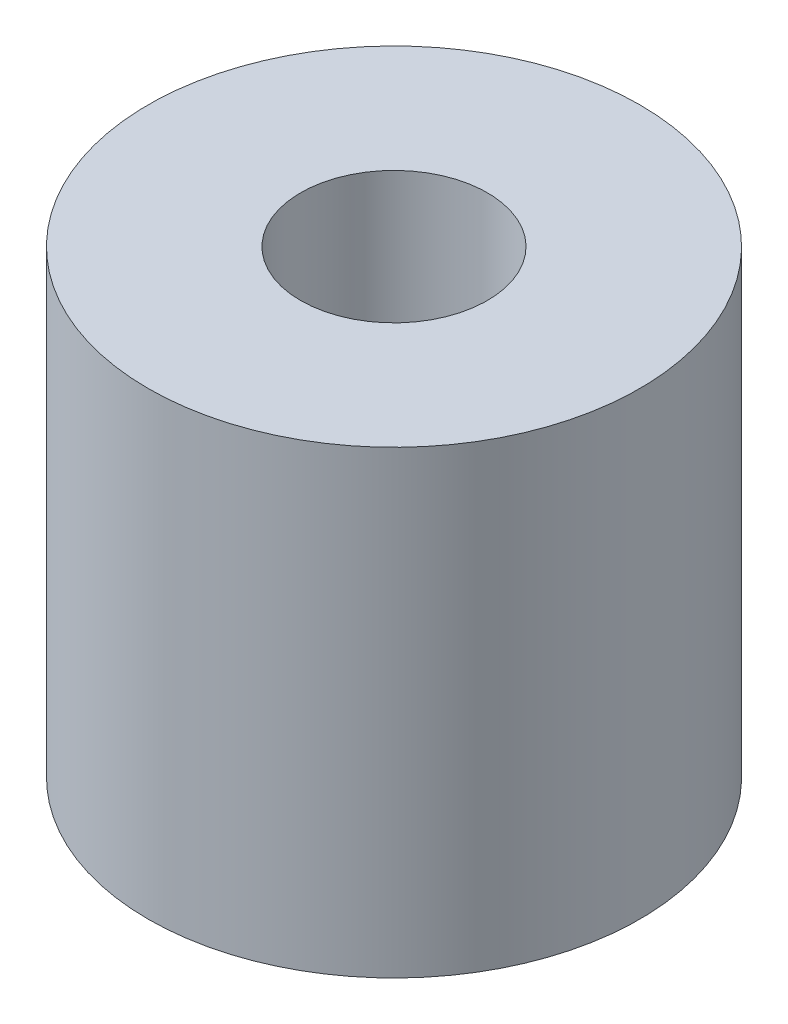
from build123d import *

# Parameters (mm, degrees)
SKETCH1_R             = 4.8125
BOSS_EXTRUDE1_DEPTH   = 9
F_6_CLEARANCE_HOLE1_D = 3.6576


with BuildPart() as part:
    # Sketch1 → Boss-Extrude1 (new body)
    with BuildSketch(Plane(origin=(0, 0, 0), x_dir=(1, 0, 0), z_dir=(0, 1, 0))):
        with Locations(Location((0, 0, 0), (0, 0, 270))):
            Circle(SKETCH1_R)
    extrude(amount=BOSS_EXTRUDE1_DEPTH)

    # #6 Clearance Hole1 (through all)
    with Locations(Plane(origin=(0, 9, 0), x_dir=(1, 0, 0), z_dir=(0, 1, 0))):
        with Locations((0, 0)):
            Hole(F_6_CLEARANCE_HOLE1_D / 2)


solid = part.part
